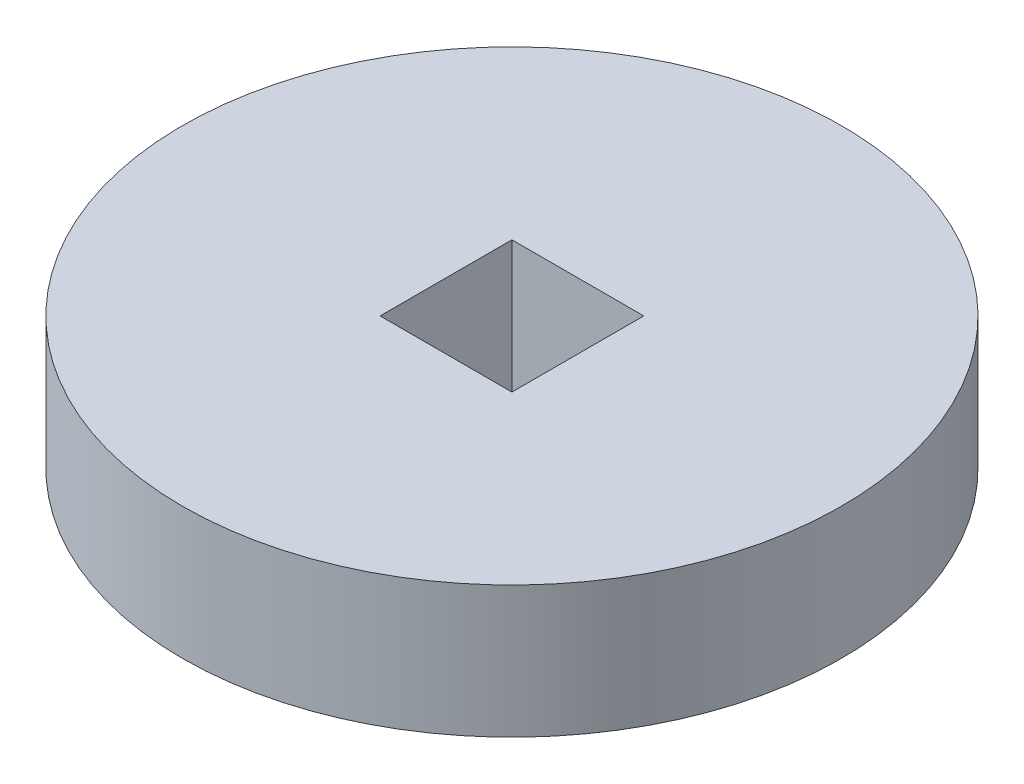
from build123d import *

# Parameters (mm, degrees)
ELEVATOR_SUPPORT_PULLEYS_R = 15.875
ELEVATOR_SUPPORT_PULLEYS_W = 6.35
ELEVATOR_SUPPORT_PULLEYS_H = 6.35
BOSS_EXTRUDE1_DEPTH        = 6.35


with BuildPart() as part:
    # Elevator Support Pulleys → Boss-Extrude1 (new body)
    with BuildSketch(Plane(origin=(0, 0, 0), x_dir=(1, 0, 0), z_dir=(0, 1, 0))):
        with Locations(Location((0, 0, 0), (0, 0, 270))):
            Circle(ELEVATOR_SUPPORT_PULLEYS_R)
        Rectangle(ELEVATOR_SUPPORT_PULLEYS_W, ELEVATOR_SUPPORT_PULLEYS_H, mode=Mode.SUBTRACT)
    extrude(amount=BOSS_EXTRUDE1_DEPTH)


solid = part.part
